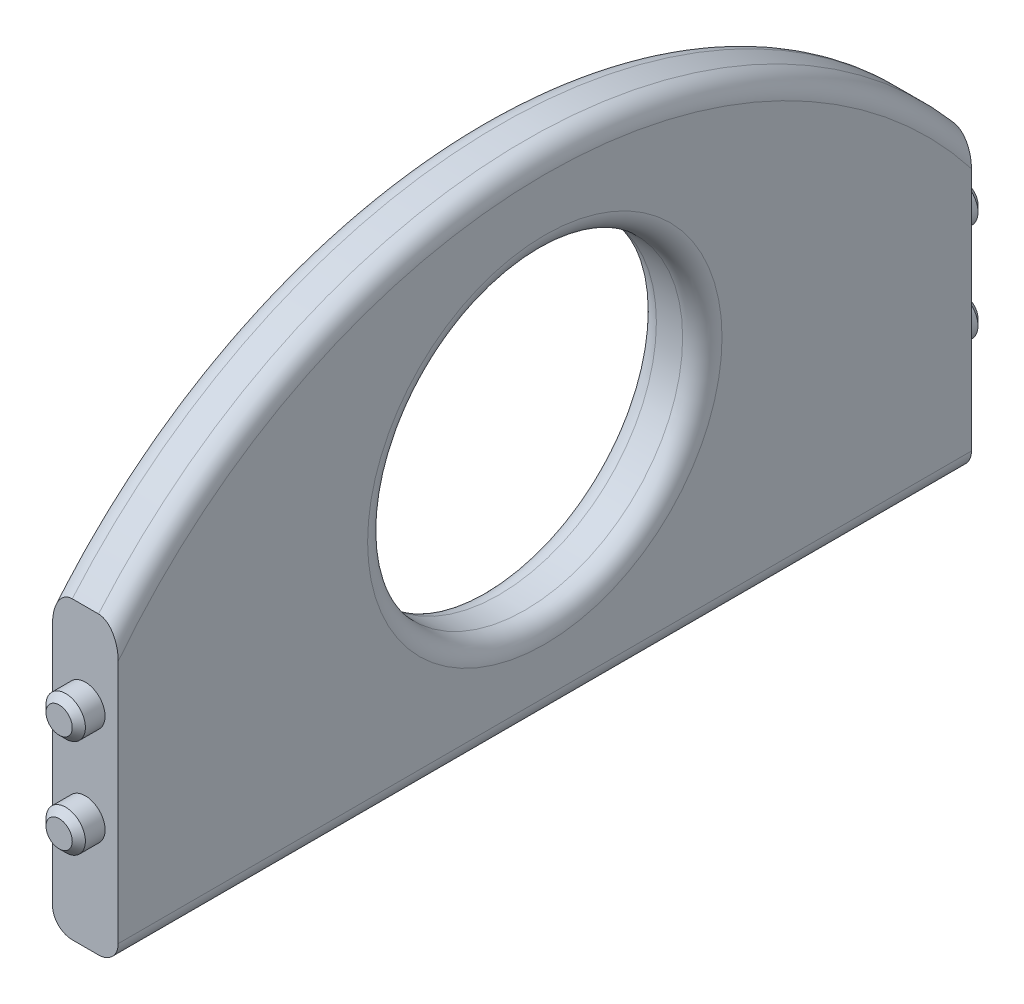
from build123d import *

# Parameters (mm, degrees)
SKETCH_1_R                 = 24
EXTRUDE_1_DEPTH            = 5
SKETCH_2_R                 = 3
EXTRUDE_2_DEPTH            = 4
CHAMFER_1_SIZE             = 1
CHAMFER_1_OF_MIRROR_1_SIZE = 1
FILLET_1_R                 = 3


with BuildPart() as part:
    # 草圖1 → 伸長1 (new, symmetric)
    with BuildSketch(Plane(origin=(0, 0, 0), x_dir=(0, 0, -1), z_dir=(1, 0, 0))):
        with BuildLine():
            Line((-65, 45), (-65, 0))
            Line((-65, 0), (65, 0))
            Line((65, 0), (65, 45))
            ThreePointArc((65, 45), (0, 75), (-65, 45))
        make_face()
        with Locations((0, 37)):
            Circle(SKETCH_1_R, mode=Mode.SUBTRACT)
    extrude(amount=EXTRUDE_1_DEPTH, both=True)

    # 草圖2 → 伸長2 (add)
    with BuildSketch(Plane.XY.offset(65)):
        with Locations(Location((0, 32, 0), (0, 0, 180))):
            Circle(SKETCH_2_R)
        with Locations(Location((0, 17, 0), (0, 0, 180))):
            Circle(SKETCH_2_R)
    extrude_2 = extrude(amount=EXTRUDE_2_DEPTH)

    # 導角1
    chamfer_1_edges = [part.edges().sort_by_distance(p)[0] for p in [
        (3, 32, 69),
        (3, 17, 69),
    ]]
    chamfer(chamfer_1_edges, length=CHAMFER_1_SIZE)

    # 鏡射1: 伸長2 across plane
    add(extrude_2.mirror(Plane.XY))

    # 導角1 of 鏡射1
    chamfer_1_of_mirror_1_edges = [part.edges().sort_by_distance(p)[0] for p in [
        (3, 32, -69),
        (3, 17, -69),
    ]]
    chamfer(chamfer_1_of_mirror_1_edges, length=CHAMFER_1_OF_MIRROR_1_SIZE)

    # 圓角1
    fillet_1_edges = [part.edges().sort_by_distance(p)[0] for p in [
        (5, 0, 0),
        (-5, 37, 24),
        (5, 37, 24),
        (5, 75, 0),
        (-5, 0, 0),
        (-5, 75, 0),
    ]]
    fillet(fillet_1_edges, radius=FILLET_1_R)


solid = part.part
